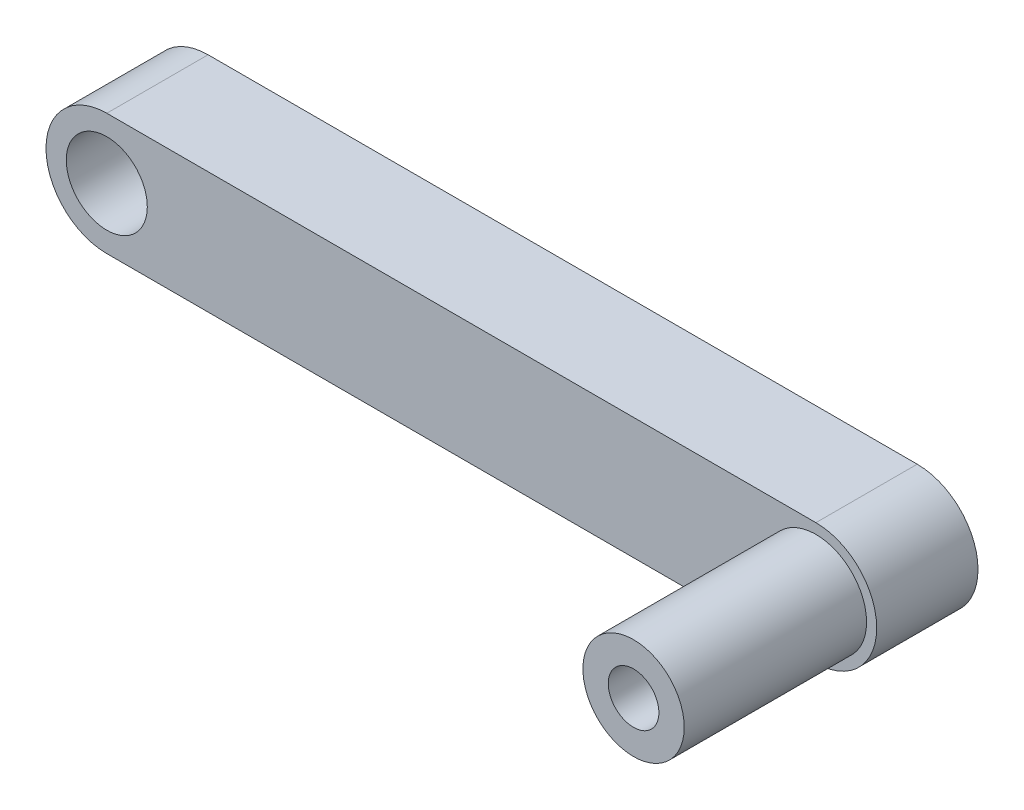
from build123d import *

# Parameters (mm, degrees)
CROQUIS1_R              = 4
SALIENTE_EXTRUIR1_DEPTH = 10
CROQUIS2_R              = 5
CROQUIS2_R_2            = 2.5
SALIENTE_EXTRUIR2_DEPTH = 18


with BuildPart() as part:
    # Croquis1 → Saliente-Extruir1 (new body)
    with BuildSketch(Plane.XY):
        with BuildLine():
            Line((60.267364884, 6), (-9.732635116, 6))
            ThreePointArc((-9.732635116, 6), (-15.732635116, 0), (-9.732635116, -6))
            Line((-9.732635116, -6), (60.267364884, -6))
            ThreePointArc((60.267364884, -6), (66.267364884, 0), (60.267364884, 6))
        make_face()
        with Locations((-9.732635116, 0)):
            Circle(CROQUIS1_R, mode=Mode.SUBTRACT)
    extrude(amount=SALIENTE_EXTRUIR1_DEPTH)

    # Croquis2 → Saliente-Extruir2 (add)
    with BuildSketch(Plane.XY.offset(10)):
        with Locations((60.267364884, 0)):
            Circle(CROQUIS2_R)
        with Locations((60.267364884, 0)):
            Circle(CROQUIS2_R_2, mode=Mode.SUBTRACT)
    extrude(amount=SALIENTE_EXTRUIR2_DEPTH)


solid = part.part
